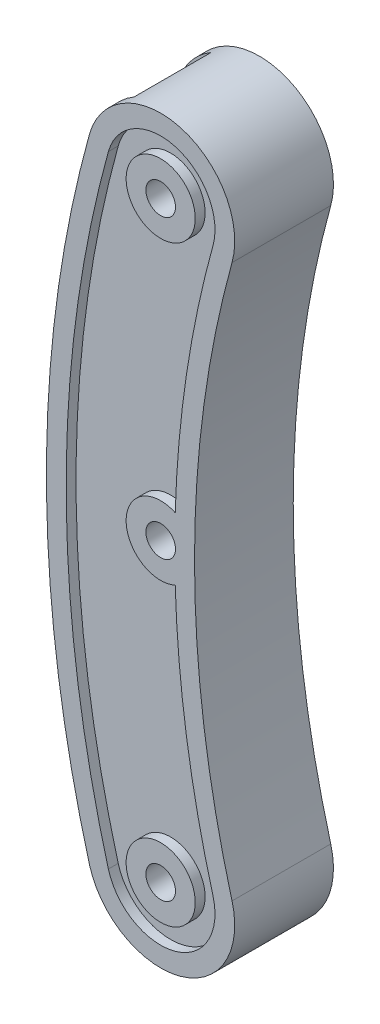
from build123d import *

# Parameters (mm, degrees)
SKETCH1_R           = 1.5
BOSS_EXTRUDE1_DEPTH = 5
SKETCH2_R           = 3.5
CUT_EXTRUDE1_DEPTH  = 1
CUT_EXTRUDE2_DEPTH  = 3.9


with BuildPart() as part:
    # Sketch1 → Boss-Extrude1 (new, symmetric)
    with BuildSketch(Plane.XY):
        with BuildLine():
            ThreePointArc((-101.197826064, -28), (-105, 0), (-101.197826064, 28))
            ThreePointArc((-101.197826064, 28), (-106.426242211, 37.228416147), (-115.654658358, 32))
            ThreePointArc((-115.654658358, 32), (-120, 0), (-115.654658358, -32))
            ThreePointArc((-115.654658358, -32), (-106.426242211, -37.228416147), (-101.197826064, -28))
        make_face()
        with Locations((-108.426242211, -30)):
            Circle(SKETCH1_R, mode=Mode.SUBTRACT)
        with Locations((-108.426242211, 0)):
            Circle(SKETCH1_R, mode=Mode.SUBTRACT)
        with Locations((-108.426242211, 30)):
            Circle(SKETCH1_R, mode=Mode.SUBTRACT)
    extrude(amount=BOSS_EXTRUDE1_DEPTH, both=True)

    # Sketch2 → Cut-Extrude1 (cut)
    with BuildSketch(Plane.XY.offset(5)):
        with BuildLine():
            ThreePointArc((-103.125403703, 28.533333333), (-106.959575544, 35.300838508), (-113.727080719, 31.466666667))
            ThreePointArc((-113.727080719, 31.466666667), (-118, 0), (-113.727080719, -31.466666667))
            ThreePointArc((-113.727080719, -31.466666667), (-106.959575544, -35.300838508), (-103.125403703, -28.533333333))
            ThreePointArc((-103.125403703, -28.533333333), (-105.801637311, -15.969143446), (-106.952890403, -3.174781008))
            ThreePointArc((-106.952890403, -3.174781008), (-111.926242211, 0), (-106.952890403, 3.174781008))
            ThreePointArc((-106.952890403, 3.174781008), (-105.801637311, 15.969143446), (-103.125403703, 28.533333333))
        make_face()
        with Locations((-108.426242211, -30)):
            Circle(SKETCH2_R, mode=Mode.SUBTRACT)
        with Locations((-108.426242211, 30)):
            Circle(SKETCH2_R, mode=Mode.SUBTRACT)
    extrude(amount=-CUT_EXTRUDE1_DEPTH, mode=Mode.SUBTRACT)

    # Sketch3 → Cut-Extrude2 (cut, symmetric)
    with BuildSketch(Plane.XY):
        with BuildLine():
            ThreePointArc((-113.727080719, 31.466666667), (-111.610121749, 38.303795152), (-109.082537558, 45))
            Line((-109.082537558, 45), (-139.082537558, 45))
            Line((-139.082537558, 45), (-139.082537558, -45))
            Line((-139.082537558, -45), (-109.082537558, -45))
            ThreePointArc((-109.082537558, -45), (-111.610121749, -38.303795152), (-113.727080719, -31.466666667))
            ThreePointArc((-113.727080719, -31.466666667), (-118, 0), (-113.727080719, 31.466666667))
        make_face()
    extrude(amount=CUT_EXTRUDE2_DEPTH, both=True, mode=Mode.SUBTRACT)


solid = part.part
